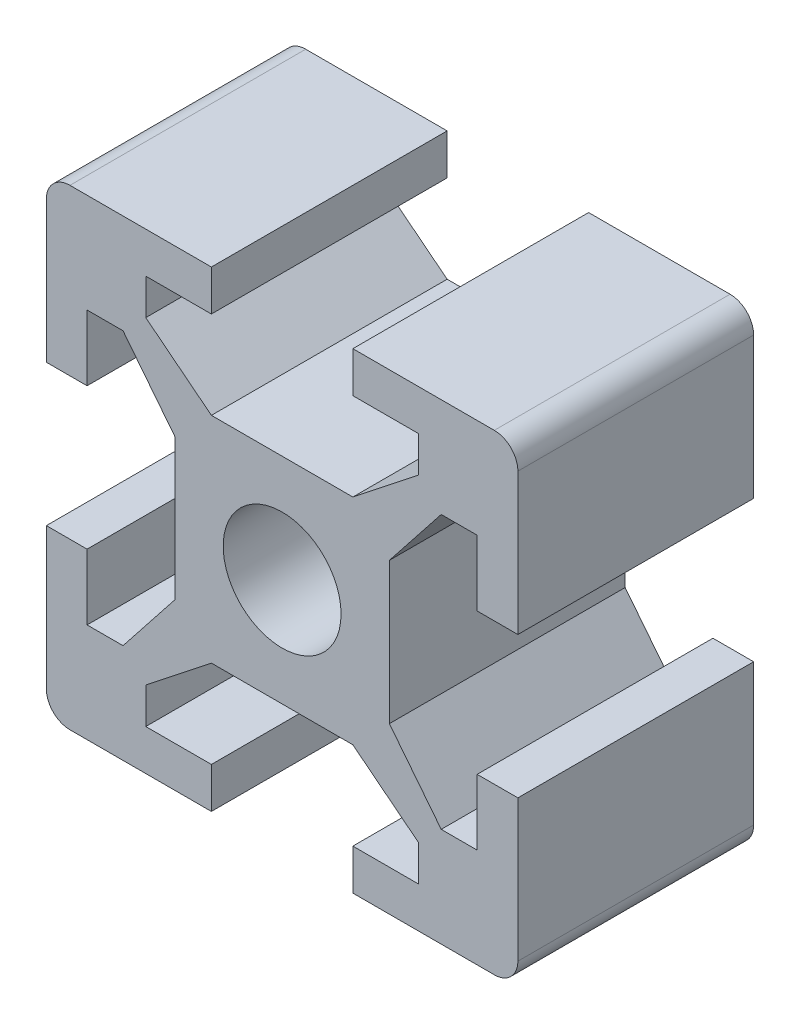
from build123d import *

# Parameters (mm, degrees)
BOSS_EXTRUDE1_DEPTH     = 5
CUT_EXTRUDE1_DEPTH      = 18.320508076
CUT_EXTRUDE1_DEPTH_BACK = 18.320508076
SKETCH2_R               = 2.5
FILLET1_R               = 1


with BuildPart() as part:
    # Sketch1 → Boss-Extrude1 (new, symmetric)
    with BuildSketch(Plane.XY):
        Polygon((-10, 10), (-3, 10), (-3, 8.272610059), (-5.783778863, 8.272610059), (-5.783778863, 6.747994248), (-3, 4.550753814), (3, 4.550753814), (5.783778863, 6.747994248), (5.783778863, 8.272610059), (3, 8.272610059), (3, 10), (10, 10), (10, 3), (8.272610059, 3), (8.272610059, 5.783778863), (6.747994248, 5.783778863), (4.55, 3.000595152), (4.55, -2.999404848), (6.747994248, -5.783778863), (8.272610059, -5.783778863), (8.272610059, -3), (10, -3), (10, -10), (3, -10), (3, -8.272610059), (5.783778863, -8.272610059), (5.783778863, -6.747994248), (2.999404848, -4.55), (-3.000595152, -4.55), (-5.783778863, -6.747994248), (-5.783778863, -8.272610059), (-3, -8.272610059), (-3, -10), (-10, -10), (-10, -3), (-8.272610059, -3), (-8.272610059, -5.783778863), (-6.747994248, -5.783778863), (-4.55, -3.000595152), (-4.55, 2.999404848), (-6.747994248, 5.783778863), (-8.272610059, 5.783778863), (-8.272610059, 3), (-10, 3), align=None)
    extrude(amount=BOSS_EXTRUDE1_DEPTH, both=True)

    # Sketch2 → Cut-Extrude1 (cut, two sides: drawn at the far end of the back side and taken through both)
    with BuildSketch(Plane.XY.offset(5).offset(-CUT_EXTRUDE1_DEPTH_BACK)):
        Circle(SKETCH2_R)
    extrude(amount=CUT_EXTRUDE1_DEPTH + CUT_EXTRUDE1_DEPTH_BACK, mode=Mode.SUBTRACT)

    # Fillet1
    fillet1_edges = [part.edges().sort_by_distance(p)[0] for p in [
        (-10, 10, 0),
        (10, 10, 0),
        (10, -10, 0),
        (-10, -10, 0),
    ]]
    fillet(fillet1_edges, radius=FILLET1_R)


solid = part.part
